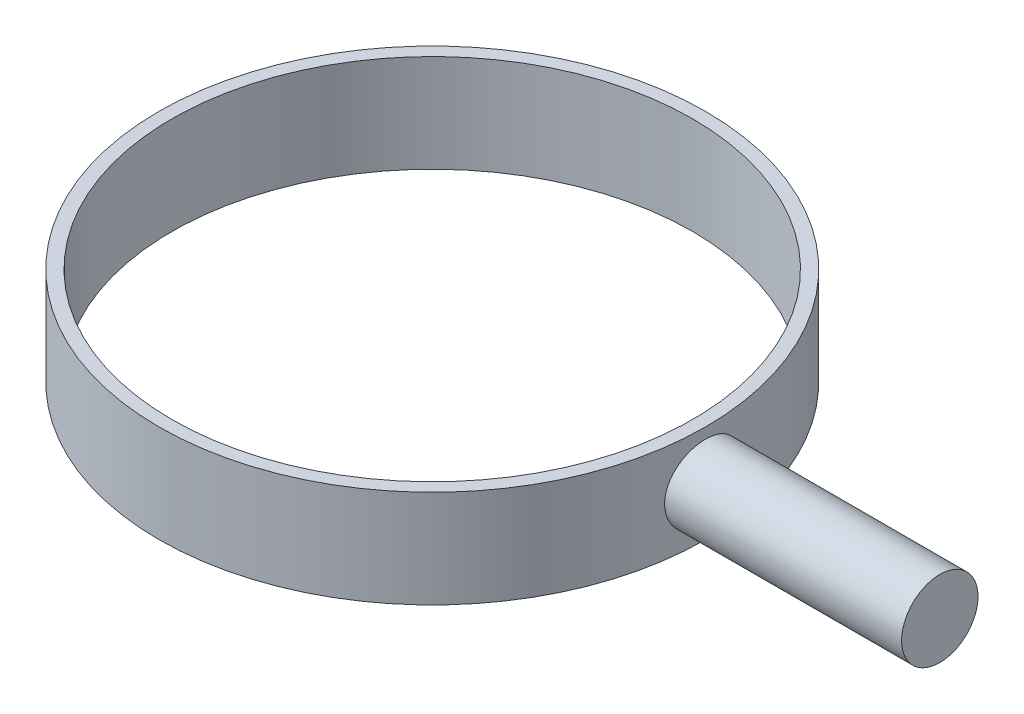
from build123d import *

# Parameters (mm, degrees)
CROQUIS1_R              = 53.34
CROQUIS1_R_2            = 50.8254
SALIENTE_EXTRUIR1_DEPTH = 9.525
CROQUIS2_R              = 7.45617
SALIENTE_EXTRUIR2_DEPTH = 99.06
CROQUIS3_R              = 50.8254
CORTAR_EXTRUIR1_DEPTH   = 49.53


with BuildPart() as part:
    # Croquis1 → Saliente-Extruir1 (new, symmetric)
    with BuildSketch(Plane(origin=(0, 0, 0), x_dir=(1, 0, 0), z_dir=(0, 1, 0))):
        with Locations(Location((0, 0, 0), (0, 0, 90))):
            Circle(CROQUIS1_R)
        with Locations(Location((0, 0, 0), (0, 0, 90))):
            Circle(CROQUIS1_R_2, mode=Mode.SUBTRACT)
    extrude(amount=SALIENTE_EXTRUIR1_DEPTH, both=True)

    # Croquis2 → Saliente-Extruir2 (add)
    with BuildSketch(Plane(origin=(0, 0, 0), x_dir=(0, 0, -1), z_dir=(1, 0, 0))):
        with Locations(Location((0, 0, 0), (0, 0, 180))):
            Circle(CROQUIS2_R)
    extrude(amount=SALIENTE_EXTRUIR2_DEPTH)

    # Croquis3 → Cortar-Extruir1 (cut, symmetric)
    with BuildSketch(Plane.XZ.offset(9.525)):
        with Locations(Location((0, 0, 0), (0, 0, 270))):
            Circle(CROQUIS3_R)
    extrude(amount=CORTAR_EXTRUIR1_DEPTH, both=True, mode=Mode.SUBTRACT)


solid = part.part
